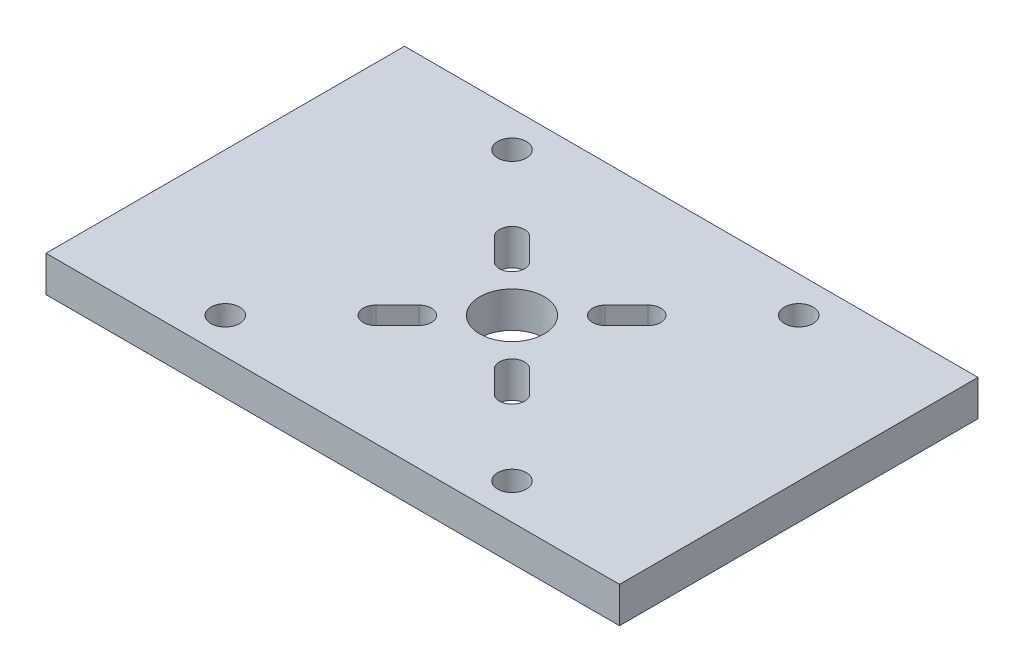
from build123d import *

# Parameters (mm, degrees)
SKETCH1_W          = 160
SKETCH1_H          = 100
BASE_DEPTH         = 10
SKETCH2_R          = 9
ACTUATOR_CUT_DEPTH = 40
CUT_EXTRUDE1_REACH = 96.868
CUT_EXTRUDE2_REACH = 96.868
SKETCH5_R          = 3
SKETCH6_R          = 4
CUT_EXTRUDE3_DEPTH = 95.868329805


with BuildPart() as part:
    # Sketch1 → base (new body)
    with BuildSketch(Plane(origin=(0, 0, 0), x_dir=(1, 0, 0), z_dir=(0, 1, 0))):
        Rectangle(SKETCH1_W, SKETCH1_H)
    extrude(amount=BASE_DEPTH)

    # Sketch2 → actuator cut (cut)
    with BuildSketch(Plane(origin=(0, 10, 0), x_dir=(1, 0, 0), z_dir=(0, 1, 0))):
        with Locations(Location((0, 0, 0), (0, 0, 270))):
            Circle(SKETCH2_R)
    extrude(amount=-ACTUATOR_CUT_DEPTH, mode=Mode.SUBTRACT)

    # Sketch3 → Cut-Extrude1 (cut, up to next)
    with BuildSketch(Plane(origin=(0, 10, 0), x_dir=(1, 0, 0), z_dir=(0, 1, 0)), mode=Mode.PRIVATE) as cut_extrude1_sk1:
        with BuildLine():
            Line((-21.474873734, -16.525126266), (-15.474873734, -10.525126266))
            ThreePointArc((-15.474873734, -10.525126266), (-10.525126266, -10.525126266), (-10.525126266, -15.474873734))
            Line((-10.525126266, -15.474873734), (-16.525126266, -21.474873734))
            ThreePointArc((-16.525126266, -21.474873734), (-21.474873734, -21.474873734), (-21.474873734, -16.525126266))
        make_face()
    cut_extrude1_tool1 = extrude(cut_extrude1_sk1.sketch, amount=-CUT_EXTRUDE1_REACH, mode=Mode.PRIVATE) & part.part
    # Sketch3 → Cut-Extrude1 (cut, up to next)
    with BuildSketch(Plane(origin=(0, 10, 0), x_dir=(1, 0, 0), z_dir=(0, 1, 0)), mode=Mode.PRIVATE) as cut_extrude1_sk2:
        with BuildLine():
            Line((21.474873734, -16.525126266), (15.474873734, -10.525126266))
            ThreePointArc((15.474873734, -10.525126266), (10.525126266, -10.525126266), (10.525126266, -15.474873734))
            Line((10.525126266, -15.474873734), (16.525126266, -21.474873734))
            ThreePointArc((16.525126266, -21.474873734), (21.474873734, -21.474873734), (21.474873734, -16.525126266))
        make_face()
    cut_extrude1_tool2 = extrude(cut_extrude1_sk2.sketch, amount=-CUT_EXTRUDE1_REACH, mode=Mode.PRIVATE) & part.part
    # Sketch3 → Cut-Extrude1 (cut, up to next)
    with BuildSketch(Plane(origin=(0, 10, 0), x_dir=(1, 0, 0), z_dir=(0, 1, 0)), mode=Mode.PRIVATE) as cut_extrude1_sk3:
        with BuildLine():
            Line((21.474873734, 16.525126266), (15.474873734, 10.525126266))
            ThreePointArc((15.474873734, 10.525126266), (10.525126266, 10.525126266), (10.525126266, 15.474873734))
            Line((10.525126266, 15.474873734), (16.525126266, 21.474873734))
            ThreePointArc((16.525126266, 21.474873734), (21.474873734, 21.474873734), (21.474873734, 16.525126266))
        make_face()
    cut_extrude1_tool3 = extrude(cut_extrude1_sk3.sketch, amount=-CUT_EXTRUDE1_REACH, mode=Mode.PRIVATE) & part.part
    # Sketch3 → Cut-Extrude1 (cut, up to next)
    with BuildSketch(Plane(origin=(0, 10, 0), x_dir=(1, 0, 0), z_dir=(0, 1, 0)), mode=Mode.PRIVATE) as cut_extrude1_sk4:
        with BuildLine():
            Line((-21.474873734, 16.525126266), (-15.474873734, 10.525126266))
            ThreePointArc((-15.474873734, 10.525126266), (-10.525126266, 10.525126266), (-10.525126266, 15.474873734))
            Line((-10.525126266, 15.474873734), (-16.525126266, 21.474873734))
            ThreePointArc((-16.525126266, 21.474873734), (-21.474873734, 21.474873734), (-21.474873734, 16.525126266))
        make_face()
    cut_extrude1_tool4 = extrude(cut_extrude1_sk4.sketch, amount=-CUT_EXTRUDE1_REACH, mode=Mode.PRIVATE) & part.part
    add(cut_extrude1_tool1.solids().sort_by_distance((-16, 10, 16))[0], mode=Mode.SUBTRACT)
    add(cut_extrude1_tool2.solids().sort_by_distance((16, 10, 16))[0], mode=Mode.SUBTRACT)
    add(cut_extrude1_tool3.solids().sort_by_distance((16, 10, -16))[0], mode=Mode.SUBTRACT)
    add(cut_extrude1_tool4.solids().sort_by_distance((-16, 10, -16))[0], mode=Mode.SUBTRACT)

    # Sketch5 → Cut-Extrude2 (cut, up to next)
    with BuildSketch(Plane(origin=(0, 10, 0), x_dir=(1, 0, 0), z_dir=(0, 1, 0)), mode=Mode.PRIVATE) as cut_extrude2_sk1:
        with Locations(Location((-40, -40, 0), (0, 0, 270))):
            Circle(SKETCH5_R)
    cut_extrude2_tool1 = extrude(cut_extrude2_sk1.sketch, amount=-CUT_EXTRUDE2_REACH, mode=Mode.PRIVATE) & part.part
    # Sketch5 → Cut-Extrude2 (cut, up to next)
    with BuildSketch(Plane(origin=(0, 10, 0), x_dir=(1, 0, 0), z_dir=(0, 1, 0)), mode=Mode.PRIVATE) as cut_extrude2_sk2:
        with Locations(Location((-40, 40, 0), (0, 0, 270))):
            Circle(SKETCH5_R)
    cut_extrude2_tool2 = extrude(cut_extrude2_sk2.sketch, amount=-CUT_EXTRUDE2_REACH, mode=Mode.PRIVATE) & part.part
    # Sketch5 → Cut-Extrude2 (cut, up to next)
    with BuildSketch(Plane(origin=(0, 10, 0), x_dir=(1, 0, 0), z_dir=(0, 1, 0)), mode=Mode.PRIVATE) as cut_extrude2_sk3:
        with Locations(Location((40, -40, 0), (0, 0, 270))):
            Circle(SKETCH5_R)
    cut_extrude2_tool3 = extrude(cut_extrude2_sk3.sketch, amount=-CUT_EXTRUDE2_REACH, mode=Mode.PRIVATE) & part.part
    # Sketch5 → Cut-Extrude2 (cut, up to next)
    with BuildSketch(Plane(origin=(0, 10, 0), x_dir=(1, 0, 0), z_dir=(0, 1, 0)), mode=Mode.PRIVATE) as cut_extrude2_sk4:
        with Locations(Location((40, 40, 0), (0, 0, 270))):
            Circle(SKETCH5_R)
    cut_extrude2_tool4 = extrude(cut_extrude2_sk4.sketch, amount=-CUT_EXTRUDE2_REACH, mode=Mode.PRIVATE) & part.part
    add(cut_extrude2_tool1.solids().sort_by_distance((-40, 10, 40))[0], mode=Mode.SUBTRACT)
    add(cut_extrude2_tool2.solids().sort_by_distance((-40, 10, -40))[0], mode=Mode.SUBTRACT)
    add(cut_extrude2_tool3.solids().sort_by_distance((40, 10, 40))[0], mode=Mode.SUBTRACT)
    add(cut_extrude2_tool4.solids().sort_by_distance((40, 10, -40))[0], mode=Mode.SUBTRACT)

    # Sketch6 → Cut-Extrude3 (cut, through all)
    with BuildSketch(Plane.XZ):
        with Locations(Location((-40, 40, 0), (0, 0, 270))):
            Circle(SKETCH6_R)
        with Locations(Location((40, 40, 0), (0, 0, 270))):
            Circle(SKETCH6_R)
        with Locations(Location((40, -40, 0), (0, 0, 270))):
            Circle(SKETCH6_R)
        with Locations(Location((-40, -40, 0), (0, 0, 270))):
            Circle(SKETCH6_R)
    extrude(amount=-CUT_EXTRUDE3_DEPTH, mode=Mode.SUBTRACT)


solid = part.part
